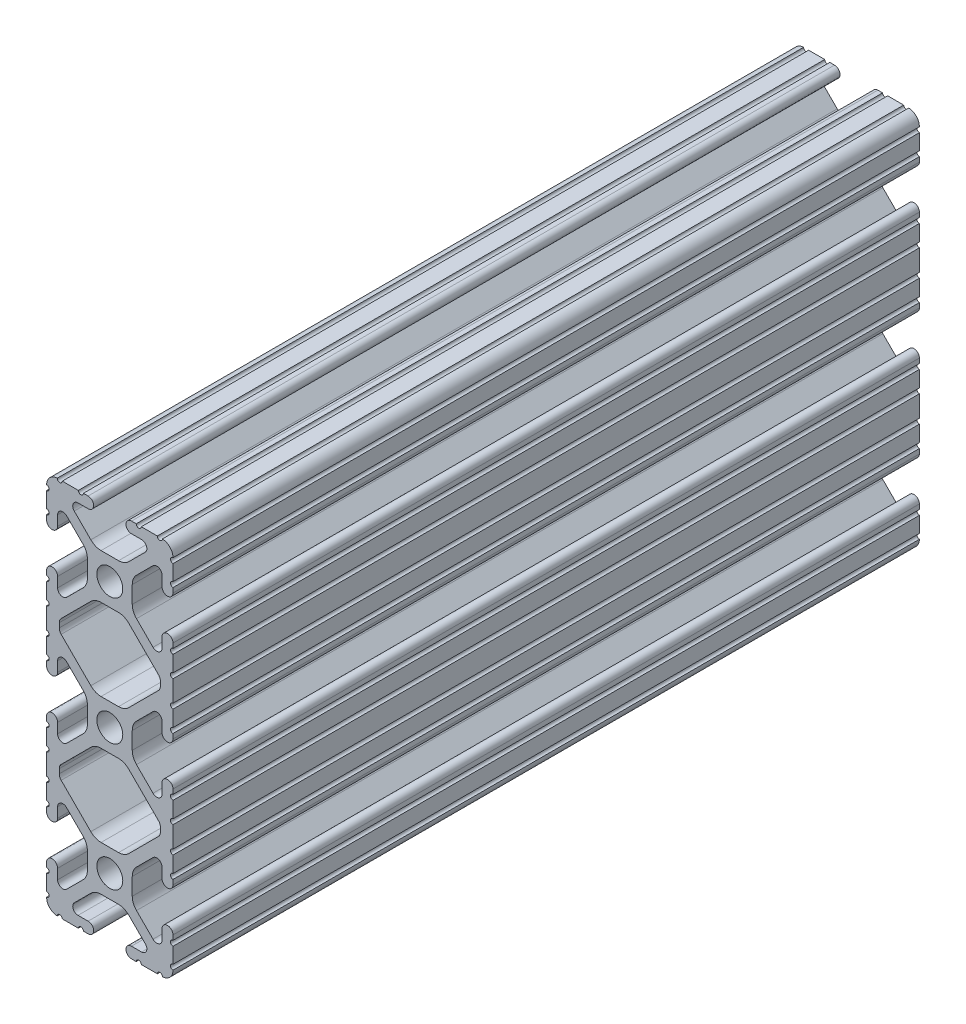
from build123d import *
from build123d.topology import SkipClean

# Parameters (mm, degrees)
BOSS_EXTRUDE1_DEPTH = 74.99985


with BuildPart() as part:
    # Sketch3 → Boss-Extrude1 (new, symmetric)
    with BuildSketch(Plane.XY):
        with BuildLine():
            Line((-4.5085, 1.724757315), (-4.5085, 0))
            Line((-4.5085, 0), (-2.6035, 0))
            ThreePointArc((-2.6035, 0), (-1.840952505, 1.840952505), (0, 2.6035))
            Line((0, 2.6035), (0, 4.5085))
            Line((0, 4.5085), (-1.757798948, 4.5085))
            ThreePointArc((-1.757798948, 4.5085), (-2.870757174, 4.729881156), (-3.8142776, 5.360321348))
            Line((-3.8142776, 5.360321348), (-9.773146637, 11.319190385))
            ThreePointArc((-9.773146637, 11.319190385), (-10.059460087, 11.747688744), (-10.16, 12.253137022))
            Line((-10.16, 12.253137022), (-10.16, 13.146862978))
            ThreePointArc((-10.16, 13.146862978), (-10.059460087, 13.652311256), (-9.773146637, 14.080809615))
            Line((-9.773146637, 14.080809615), (-3.8142776, 20.039678652))
            ThreePointArc((-3.8142776, 20.039678652), (-2.870757174, 20.670118844), (-1.757798948, 20.8915))
            Line((-1.757798948, 20.8915), (0, 20.8915))
            Line((0, 20.8915), (0, 22.7965))
            ThreePointArc((0, 22.7965), (-2.6035, 25.4), (0, 28.0035))
            Line((0, 28.0035), (0, 29.9085))
            Line((0, 29.9085), (-1.757798948, 29.9085))
            ThreePointArc((-1.757798948, 29.9085), (-2.870757174, 30.129881156), (-3.8142776, 30.760321348))
            Line((-3.8142776, 30.760321348), (-7.140358942, 34.086402691))
            ThreePointArc((-7.140358942, 34.086402691), (-7.369409702, 35.237918622), (-6.393201633, 35.8902))
            Line((-6.393201633, 35.8902), (-4.3561, 35.8902))
            ThreePointArc((-4.3561, 35.8902), (-3.2512, 36.9951), (-4.3561, 38.1))
            Line((-4.3561, 38.1), (-5.3086, 38.1))
            ThreePointArc((-5.3086, 38.1), (-5.8166, 37.592), (-6.3246, 38.1))
            Line((-6.3246, 38.1), (-9.5504, 38.1))
            ThreePointArc((-9.5504, 38.1), (-10.0584, 37.592), (-10.5664, 38.1))
            ThreePointArc((-10.5664, 38.1), (-12.079551533, 37.426060101), (-12.7, 35.8902))
            ThreePointArc((-12.7, 35.8902), (-12.192, 35.3822), (-12.7, 34.8742))
            Line((-12.7, 34.8742), (-12.7, 31.7246))
            ThreePointArc((-12.7, 31.7246), (-12.192, 31.2166), (-12.7, 30.7086))
            Line((-12.7, 30.7086), (-12.7, 29.7561))
            ThreePointArc((-12.7, 29.7561), (-11.5951, 28.6512), (-10.4902, 29.7561))
            Line((-10.4902, 29.7561), (-10.4902, 31.76016))
            ThreePointArc((-10.4902, 31.76016), (-9.837918622, 32.736368069), (-8.686402691, 32.507317309))
            Line((-8.686402691, 32.507317309), (-5.360321348, 29.181235967))
            ThreePointArc((-5.360321348, 29.181235967), (-4.729881156, 28.237715541), (-4.5085, 27.124757315))
            Line((-4.5085, 27.124757315), (-4.5085, 23.675242685))
            ThreePointArc((-4.5085, 23.675242685), (-4.729881156, 22.562284459), (-5.360321348, 21.618764033))
            Line((-5.360321348, 21.618764033), (-8.686402691, 18.292682691))
            ThreePointArc((-8.686402691, 18.292682691), (-9.837918622, 18.063631931), (-10.4902, 19.03984))
            Line((-10.4902, 19.03984), (-10.4902, 21.0439))
            ThreePointArc((-10.4902, 21.0439), (-11.5951, 22.1488), (-12.7, 21.0439))
            Line((-12.7, 21.0439), (-12.7, 20.0914))
            ThreePointArc((-12.7, 20.0914), (-12.192, 19.5834), (-12.7, 19.0754))
            Line((-12.7, 19.0754), (-12.7, 15.8496))
            ThreePointArc((-12.7, 15.8496), (-12.192, 15.3416), (-12.7, 14.8336))
            Line((-12.7, 14.8336), (-12.7, 10.5664))
            ThreePointArc((-12.7, 10.5664), (-12.192, 10.0584), (-12.7, 9.5504))
            Line((-12.7, 9.5504), (-12.7, 6.3246))
            ThreePointArc((-12.7, 6.3246), (-12.192, 5.8166), (-12.7, 5.3086))
            Line((-12.7, 5.3086), (-12.7, 4.3561))
            ThreePointArc((-12.7, 4.3561), (-11.5951, 3.2512), (-10.4902, 4.3561))
            Line((-10.4902, 4.3561), (-10.4902, 6.36016))
            ThreePointArc((-10.4902, 6.36016), (-9.837918622, 7.336368069), (-8.686402691, 7.107317309))
            Line((-8.686402691, 7.107317309), (-5.360321348, 3.781235967))
            ThreePointArc((-5.360321348, 3.781235967), (-4.729881156, 2.837715541), (-4.5085, 1.724757315))
        make_face()
    extrude(amount=BOSS_EXTRUDE1_DEPTH, both=True)

    # Mirror1: part across plane


with BuildPart() as part_1:
    with SkipClean():  # the faces are left unmerged after this step: merging them gives an invalid solid
        add(part.part)
        add(part.part.mirror(Plane(origin=(0, 0, 0), x_dir=(0, 0, 1), z_dir=(1, 0, 0))))

    # Mirror2: part across plane


with BuildPart() as part_2:
    with SkipClean():  # the faces are left unmerged after this step: merging them gives an invalid solid
        add(part_1.part)
        add(part_1.part.mirror(Plane.ZX))


solid = part_2.part
